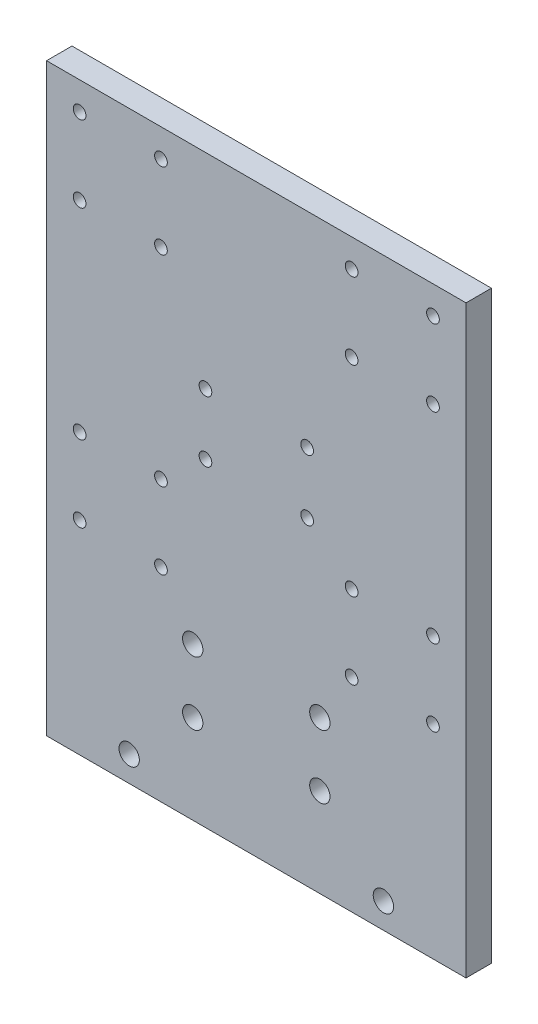
from build123d import *

# Parameters (mm, degrees)
SKETCH1_W           = 165
SKETCH1_H           = 230
BOSS_EXTRUDE1_DEPTH = 10
OTW_R_5_0_5_1_D     = 5
OTW_R_8_0_8_1_D     = 8
OTW_R_8_0_8_2_D     = 8


with BuildPart() as part:
    # Sketch1 → Boss-Extrude1 (new body)
    with BuildSketch(Plane.XY):
        Rectangle(SKETCH1_W, SKETCH1_H)
    extrude(amount=BOSS_EXTRUDE1_DEPTH)

    # Otwór Ø5.0 (5)1 (through all)
    with Locations(Plane(origin=(0, 0, 0), x_dir=(-1, 0, 0), z_dir=(0, 0, -1))):
        with Locations((-69.5, 104), (-37.5, 104), (-37.5, 74), (-69.5, 74), (-69.5, -5), (-37.5, -5), (-37.5, -35), (-69.5, -35), (37.5, 104), (69.5, 104), (69.5, 74), (37.5, 74), (37.5, -5), (69.5, -5), (69.5, -35), (37.5, -35), (-20, 34.5), (20, 34.5), (20, 10.5), (-20, 10.5)):
            Hole(OTW_R_5_0_5_1_D / 2)

    # Otwór Ø8.0 (8)1 (through all)
    with Locations(Plane.XY.offset(10)):
        with Locations((-25, -55), (25, -55), (25, -80), (-25, -80)):
            Hole(OTW_R_8_0_8_1_D / 2)

    # Otwór Ø8.0 (8)2 (through all)
    with Locations(Plane.XY.offset(10)):
        with Locations((50, -105), (-50, -105)):
            Hole(OTW_R_8_0_8_2_D / 2)


solid = part.part
